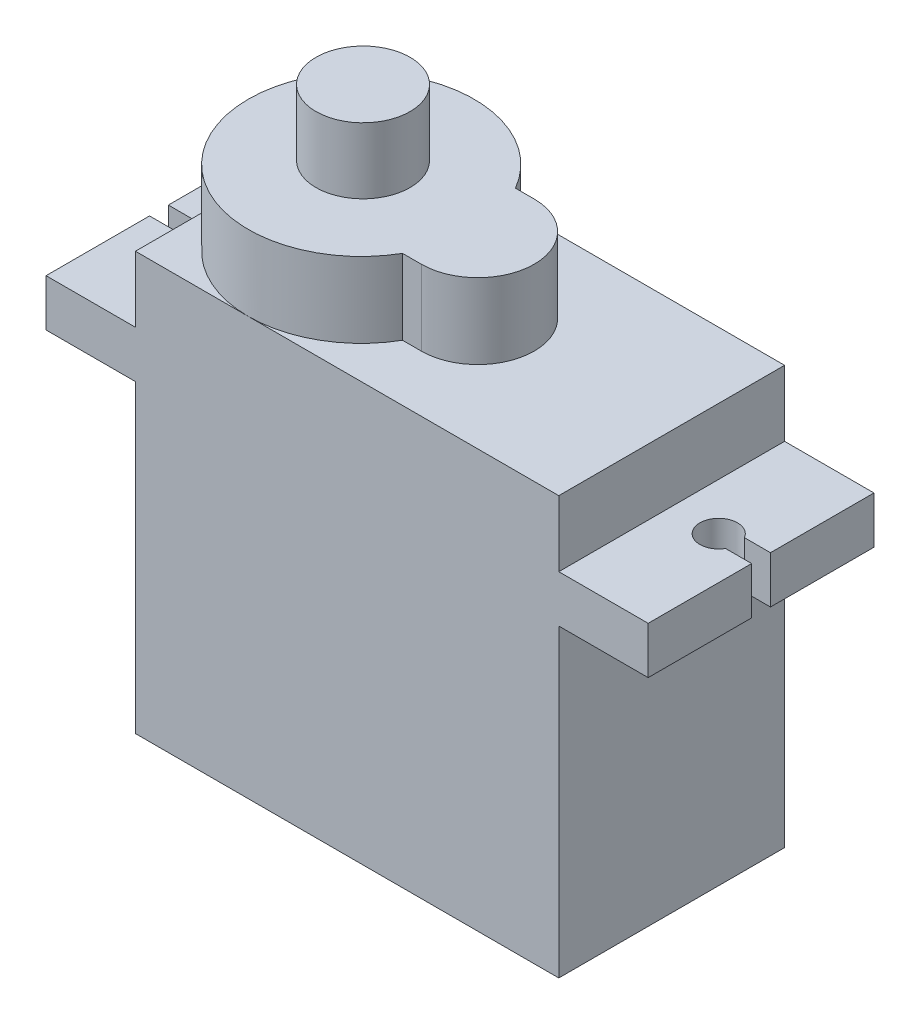
from build123d import *

# Parameters (mm, degrees)
SKETCH1_W           = 22.5
SKETCH1_H           = 22.2
BOSS_EXTRUDE1_DEPTH = 6
BOSS_EXTRUDE2_DEPTH = 4
SKETCH3_R           = 2.5
BOSS_EXTRUDE3_DEPTH = 3.5
SKETCH4_W           = 12
SKETCH4_H           = 2.5
BOSS_EXTRUDE4_DEPTH = 16
CUT_EXTRUDE1_DEPTH  = 2.5


with BuildPart() as part:
    # Sketch1 → Boss-Extrude1 (new, symmetric)
    with BuildSketch(Plane.XY):
        with Locations((0, 11.1)):
            Rectangle(SKETCH1_W, SKETCH1_H)
    extrude(amount=BOSS_EXTRUDE1_DEPTH, both=True)

    # Sketch2 → Boss-Extrude2 (add)
    with BuildSketch(Plane(origin=(0, 22.2, 0), x_dir=(1, 0, 0), z_dir=(0, 1, 0))):
        with BuildLine():
            Line((0.946152423, 3), (-0.053847577, 3))
            ThreePointArc((-0.053847577, 3), (-11.25, 0), (-0.053847577, -3))
            Line((-0.053847577, -3), (0.946152423, -3))
            ThreePointArc((0.946152423, -3), (3.946152423, 0), (0.946152423, 3))
        make_face()
    extrude(amount=BOSS_EXTRUDE2_DEPTH)

    # Sketch3 → Boss-Extrude3 (add)
    with BuildSketch(Plane(origin=(0, 26.2, 0), x_dir=(1, 0, 0), z_dir=(0, 1, 0))):
        with Locations(Location((-5.379476527, 0.226239141, 0), (0, 0, 270))):
            Circle(SKETCH3_R)
    extrude(amount=BOSS_EXTRUDE3_DEPTH)

    # Sketch4 → Boss-Extrude4 (add, symmetric)
    with BuildSketch(Plane(origin=(0, 0, 0), x_dir=(0, 0, -1), z_dir=(1, 0, 0))):
        with Locations((0, 17.45)):
            Rectangle(SKETCH4_W, SKETCH4_H)
    extrude(amount=BOSS_EXTRUDE4_DEPTH, both=True)

    # Sketch5 → Cut-Extrude1 (cut)
    with BuildSketch(Plane(origin=(0, 18.7, 0), x_dir=(1, 0, 0), z_dir=(0, 1, 0))):
        with BuildLine():
            Line((14.616025404, 0.5), (16, 0.5))
            Line((16, 0.5), (16, -0.5))
            Line((16, -0.5), (14.616025404, -0.5))
            ThreePointArc((14.616025404, -0.5), (12.75, 0), (14.616025404, 0.5))
        make_face()
    cut_extrude1 = extrude(amount=-CUT_EXTRUDE1_DEPTH, mode=Mode.SUBTRACT)

    # Mirror1: Cut-Extrude1 across plane
    add(cut_extrude1.mirror(Plane(origin=(0, 0, 0), x_dir=(0, 0, 1), z_dir=(1, 0, 0))), mode=Mode.SUBTRACT)


solid = part.part
